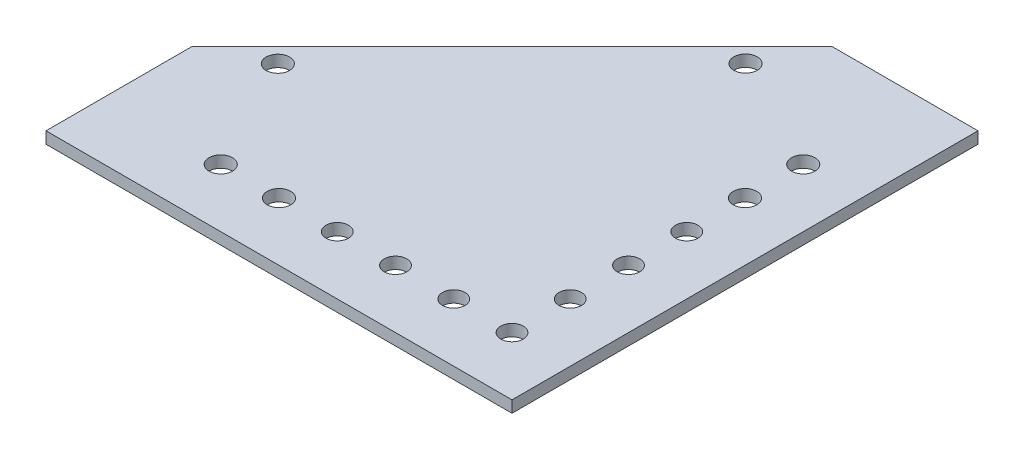
from build123d import *

# Parameters (mm, degrees)
BOSS_EXTRUDE1_DEPTH          = 1.27
F_10_0_1935_DIAMETER_HOLE1_D = 4.9149
F_10_CLEARANCE_HOLE3_D       = 5.1054
SKETCH8_W                    = 182.273007985
SKETCH8_H                    = 142.759278982
SKETCH8_W_2                  = 101.6
SKETCH8_H_2                  = 101.6
CUT_EXTRUDE1_DEPTH           = 114.076021494


with BuildPart() as part:
    # Sketch1 → Boss-Extrude1 (new, symmetric)
    with BuildSketch(Plane(origin=(0, 0, 0), x_dir=(1, 0, 0), z_dir=(0, 1, 0))):
        with BuildLine():
            Line((53.835856574, 81.994245871), (53.835856574, -36.025498008))
            Line((53.835856574, -36.025498008), (-64.183887305, -36.025498008))
            ThreePointArc((-64.183887305, -36.025498008), (-70.050522337, -32.105537803), (-68.674015366, -25.185369947))
            Line((-68.674015366, -25.185369947), (42.995728513, 86.484373931))
            ThreePointArc((42.995728513, 86.484373931), (49.915896369, 87.860880902), (53.835856574, 81.994245871))
        make_face()
    extrude(amount=BOSS_EXTRUDE1_DEPTH, both=True)

    # #10 (0.1935) Diameter Hole1 (through all)
    with Locations(Plane(origin=(0, 1.27, 0), x_dir=(1, 0, 0), z_dir=(0, 1, 0))):
        with Locations((41.135856574, -23.325498008), (28.435856574, -23.325498008), (15.735856574, -23.325498008), (3.035856574, -23.325498008), (41.135856574, -10.625498008), (41.135856574, 2.074501992), (41.135856574, 14.774501992)):
            Hole(F_10_0_1935_DIAMETER_HOLE1_D / 2)

    # #10 Clearance Hole3 (through all)
    with Locations(Plane(origin=(0, 1.27, 0), x_dir=(1, 0, 0), z_dir=(0, 1, 0))):
        with Locations((-9.664143426, -23.325498008), (-22.364143426, -23.325498008), (41.135856574, 27.474501992), (41.135856574, 40.174501992), (15.795798418, 52.929822822), (-35.153913001, 1.902635256)):
            Hole(F_10_CLEARANCE_HOLE3_D / 2)

    # Sketch8 → Cut-Extrude1 (cut, through all)
    with BuildSketch(Plane(origin=(0, 1.27, 0), x_dir=(1, 0, 0), z_dir=(0, 1, 0))):
        with Locations((14.049390588, 20.35997908)):
            Rectangle(SKETCH8_W, SKETCH8_H)
        with Locations((3.035856574, 14.774501992)):
            Rectangle(SKETCH8_W_2, SKETCH8_H_2, mode=Mode.SUBTRACT)
    extrude(amount=-CUT_EXTRUDE1_DEPTH, mode=Mode.SUBTRACT)


solid = part.part
